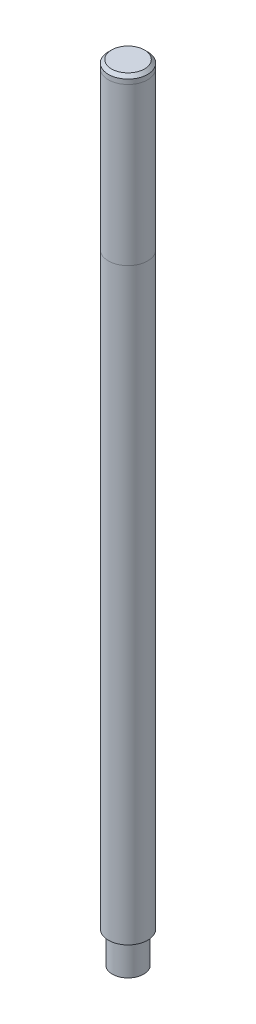
from build123d import *

# Parameters (mm, degrees)
SKETCH1_R           = 12.5
BOSS_EXTRUDE1_DEPTH = 250
CHAMFER1_SIZE       = 2
CUT_EXTRUDE1_START  = -20
SKETCH3_R           = 12.5
SKETCH3_R_2         = 10
CUT_EXTRUDE1_DEPTH  = 20


with BuildPart() as part:
    # Sketch1 → Boss-Extrude1 (new, symmetric)
    with BuildSketch(Plane(origin=(0, 0, 0), x_dir=(1, 0, 0), z_dir=(0, 1, 0))):
        with Locations(Location((0, 0, 0), (0, 0, 270))):
            Circle(SKETCH1_R)
    extrude(amount=BOSS_EXTRUDE1_DEPTH, both=True)

    # Chamfer1
    chamfer1_edges = [part.edges().sort_by_distance(p)[0] for p in [
        (0, 250, -12.5),
    ]]
    chamfer(chamfer1_edges, length=CHAMFER1_SIZE)

    # Sketch3 → Cut-Extrude1 (cut)
    with BuildSketch(Plane.XZ.offset(250).offset(CUT_EXTRUDE1_START)):
        with Locations(Location((0, 0, 0), (0, 0, 270))):
            Circle(SKETCH3_R)
        with Locations(Location((0, 0, 0), (0, 0, 270))):
            Circle(SKETCH3_R_2, mode=Mode.SUBTRACT)
    extrude(amount=CUT_EXTRUDE1_DEPTH, mode=Mode.SUBTRACT)


solid = part.part
